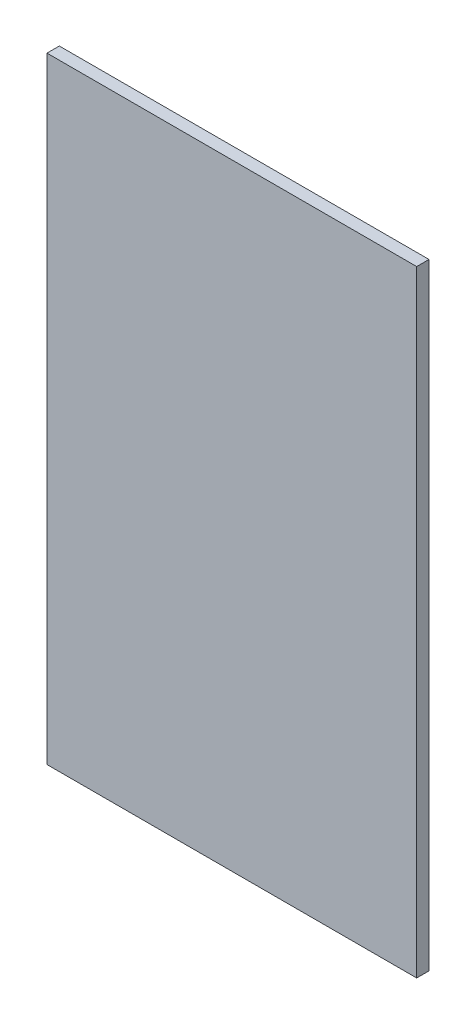
from build123d import *

# Parameters (mm, degrees)
SKETCH1_W           = 90
SKETCH1_H           = 150
BOSS_EXTRUDE1_DEPTH = 3


with BuildPart() as part:
    # Sketch1 → Boss-Extrude1 (new body)
    with BuildSketch(Plane.XY):
        with Locations((45, 75)):
            Rectangle(SKETCH1_W, SKETCH1_H)
    extrude(amount=BOSS_EXTRUDE1_DEPTH)


solid = part.part
